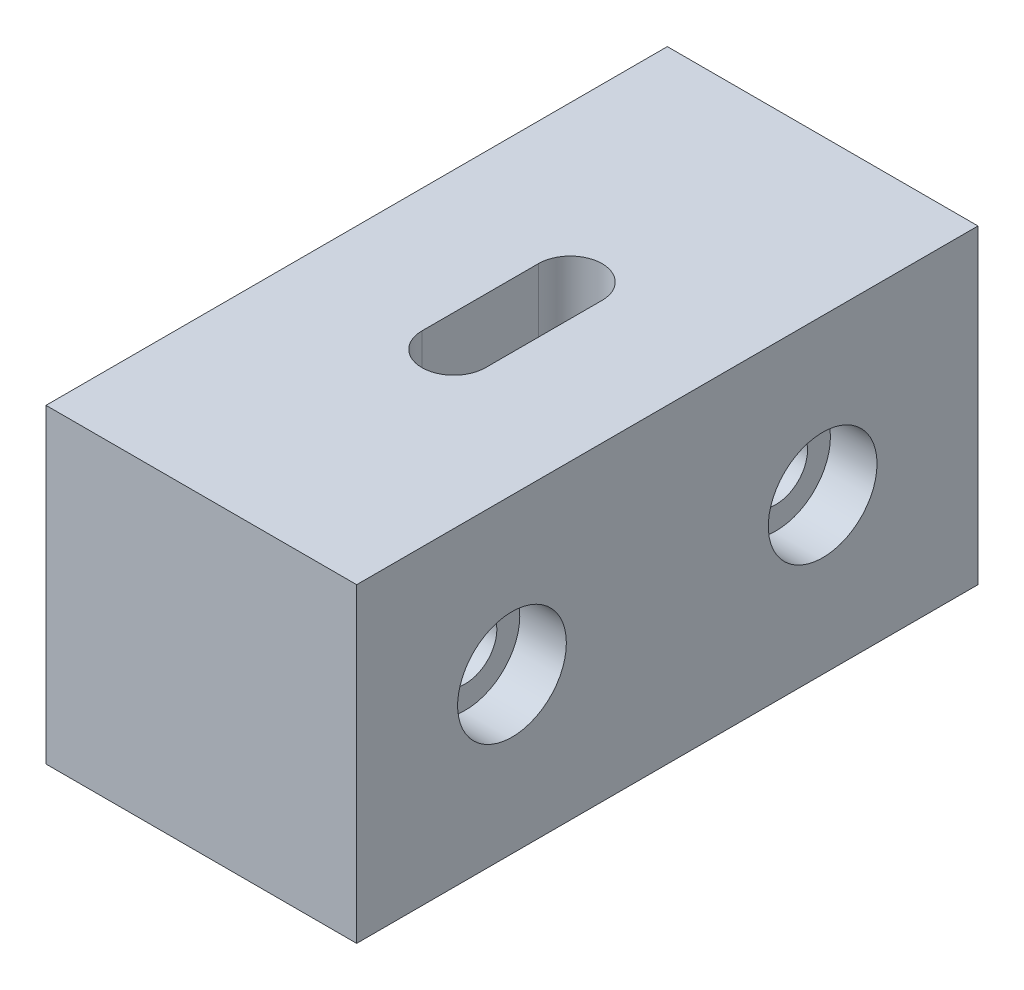
from build123d import *

# Parameters (mm, degrees)
BOSS_EXTRUDE1_DEPTH      = 40
BOSS_EXTRUDE1_DEPTH_BACK = 40
SKETCH1_W                = 40
SKETCH1_H                = 40
CUT_EXTRUDE1_DEPTH       = 80
CUT_EXTRUDE1_DEPTH_BACK  = 80
SKETCH2_R                = 4.05
CUT_EXTRUDE2_START       = 20
SKETCH3_R                = 7
CUT_EXTRUDE2_DEPTH       = 6
CUT_EXTRUDE3_DEPTH       = 36
CUT_EXTRUDE3_DEPTH_BACK  = 36


with BuildPart() as part:
    # Sketch1 → Boss-Extrude1 (new, two sides: drawn at the far end of the back side and taken through both)
    with BuildSketch(Plane.XY.offset(-BOSS_EXTRUDE1_DEPTH_BACK)):
        Rectangle(SKETCH1_W, SKETCH1_H)
    extrude(amount=BOSS_EXTRUDE1_DEPTH + BOSS_EXTRUDE1_DEPTH_BACK)

    # Sketch2 → Cut-Extrude1 (cut, two sides: drawn at the far end of the back side and taken through both)
    with BuildSketch(Plane(origin=(0, 0, 0), x_dir=(0, 0, -1), z_dir=(1, 0, 0)).offset(-CUT_EXTRUDE1_DEPTH_BACK)):
        with Locations((-20, 0)):
            Circle(SKETCH2_R)
        with Locations((20, 0)):
            Circle(SKETCH2_R)
    extrude(amount=CUT_EXTRUDE1_DEPTH + CUT_EXTRUDE1_DEPTH_BACK, mode=Mode.SUBTRACT)

    # Sketch3 → Cut-Extrude2 (cut)
    with BuildSketch(Plane(origin=(0, 0, 0), x_dir=(0, 0, -1), z_dir=(1, 0, 0)).offset(CUT_EXTRUDE2_START)):
        with Locations((-20, 0)):
            Circle(SKETCH3_R)
        with Locations((20, 0)):
            Circle(SKETCH3_R)
    extrude(amount=-CUT_EXTRUDE2_DEPTH, mode=Mode.SUBTRACT)

    # Sketch4 → Cut-Extrude3 (cut, two sides: drawn at the far end of the back side and taken through both)
    with BuildSketch(Plane(origin=(0, 0, 0), x_dir=(1, 0, 0), z_dir=(0, 1, 0)).offset(-CUT_EXTRUDE3_DEPTH_BACK)):
        with BuildLine():
            Line((-4.1, -7.5), (-4.1, 7.5))
            ThreePointArc((-4.1, 7.5), (0, 11.6), (4.1, 7.5))
            Line((4.1, 7.5), (4.1, -7.5))
            ThreePointArc((4.1, -7.5), (0, -11.6), (-4.1, -7.5))
        make_face()
    extrude(amount=CUT_EXTRUDE3_DEPTH + CUT_EXTRUDE3_DEPTH_BACK, mode=Mode.SUBTRACT)


solid = part.part
